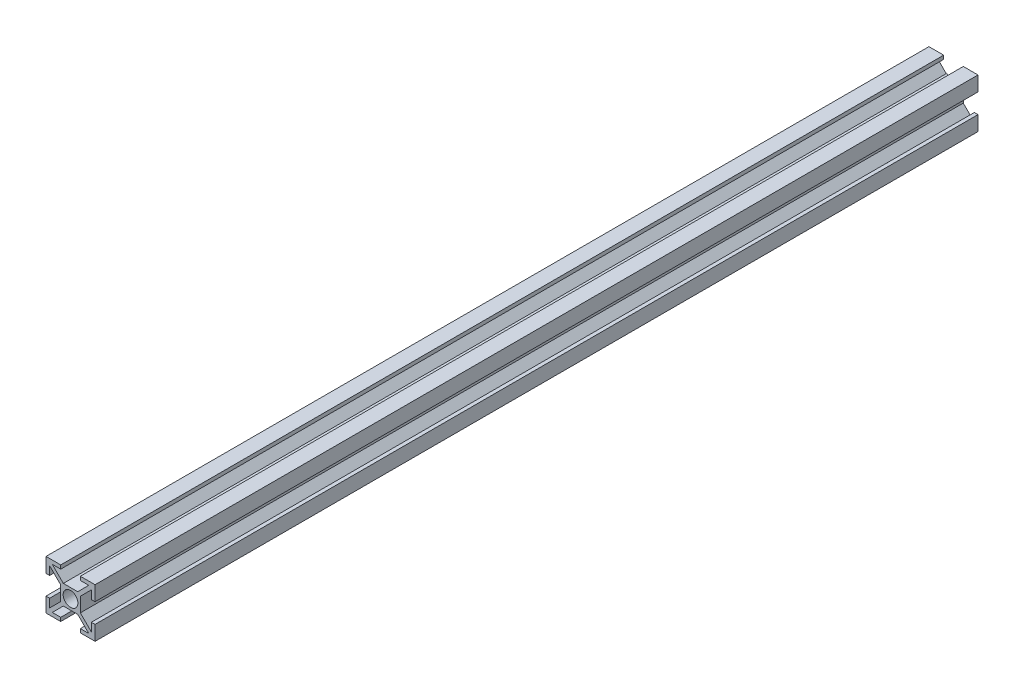
from build123d import *

# Parameters (mm, degrees)
ESBO_O1_R                = 3
RESSALTO_EXTRUS_O1_DEPTH = 360


with BuildPart() as part:
    # Esboço1 → Ressalto-extrusão1 (new body)
    with BuildSketch(Plane.XY):
        Polygon((-2.939339828, 4), (2.939339828, 4), (7.439339828, 8.5), (4, 8.5), (4, 10), (10, 10), (10, 4), (8.5, 4), (8.5, 7.439339828), (4, 2.939339828), (4, -2.939339828), (8.5, -7.439339828), (8.5, -4), (10, -4), (10, -10), (4, -10), (4, -8.5), (7.439339828, -8.5), (2.939339828, -4), (-2.939339828, -4), (-7.439339828, -8.5), (-4, -8.5), (-4, -10), (-10, -10), (-10, -4), (-8.5, -4), (-8.5, -7.439339828), (-4, -2.939339828), (-4, 2.939339828), (-8.5, 7.439339828), (-8.5, 4), (-10, 4), (-10, 10), (-4, 10), (-4, 8.5), (-7.439339828, 8.5), align=None)
        with Locations(Location((0, 0, 0), (0, 0, 180))):
            Circle(ESBO_O1_R, mode=Mode.SUBTRACT)
    extrude(amount=RESSALTO_EXTRUS_O1_DEPTH)


solid = part.part
